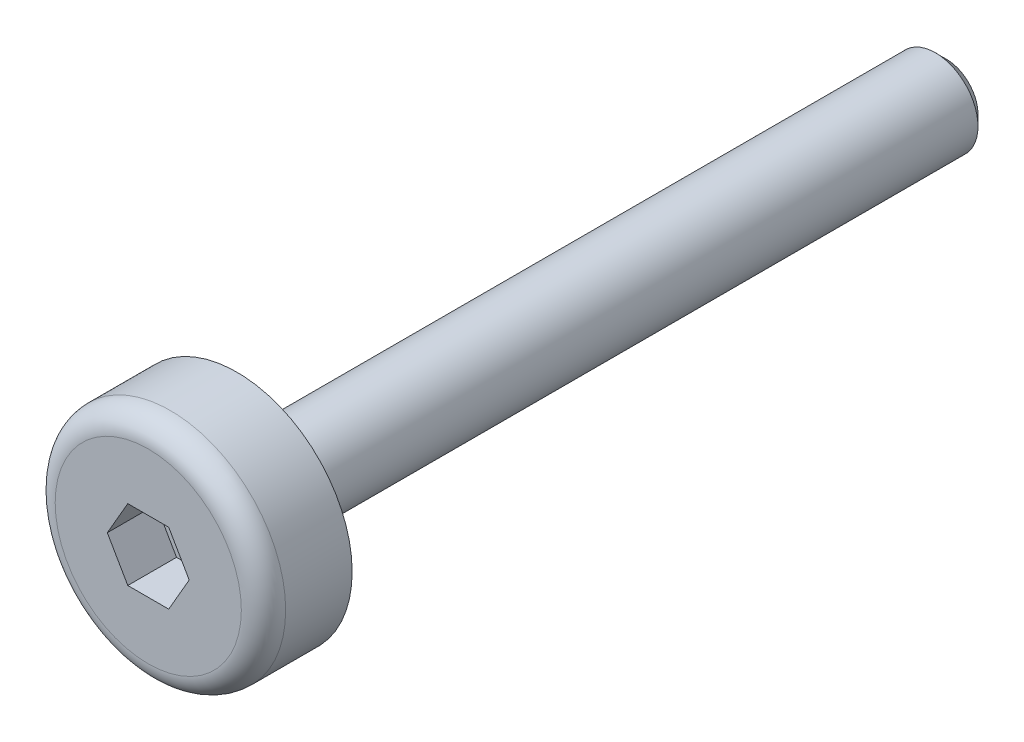
from build123d import *

# Parameters (mm, degrees)
SHANK_TIP_CHAMFER_SIZE = 0.3
PAN_HEAD_ROUND_R       = 0.625
HEX_DRIVE_CUT_DEPTH    = 1.375


with BuildPart() as part:
    # Screw Section → Screw Blank Revolve (revolve)
    with BuildSketch(Plane(origin=(0, 0, 0), x_dir=(1, 0, 0), z_dir=(0, 1, 0))):
        Polygon((0, 20), (1.2, 20), (1.2, 0), (3.25, 0), (3.25, -2.5), (0, -2.5), align=None)
    revolve(axis=Axis((0, 0, 10.123), (0, 0, -1)))

    # Shank Tip Chamfer
    shank_tip_chamfer_edges = [part.edges().sort_by_distance(p)[0] for p in [
        (-1.2, 0, -20),
    ]]
    chamfer(shank_tip_chamfer_edges, length=SHANK_TIP_CHAMFER_SIZE)

    # Pan Head Round
    pan_head_round_edges = [part.edges().sort_by_distance(p)[0] for p in [
        (-3.25, 0, 2.5),
    ]]
    fillet(pan_head_round_edges, radius=PAN_HEAD_ROUND_R)

    # Hex Drive Sketch → Hex Drive Cut (cut)
    with BuildSketch(Plane.XY.offset(2.5)):
        Polygon((1.154700538, 0), (0.577350269, 1), (-0.577350269, 1), (-1.154700538, 0), (-0.577350269, -1), (0.577350269, -1), align=None)
    extrude(amount=-HEX_DRIVE_CUT_DEPTH, mode=Mode.SUBTRACT)


solid = part.part
